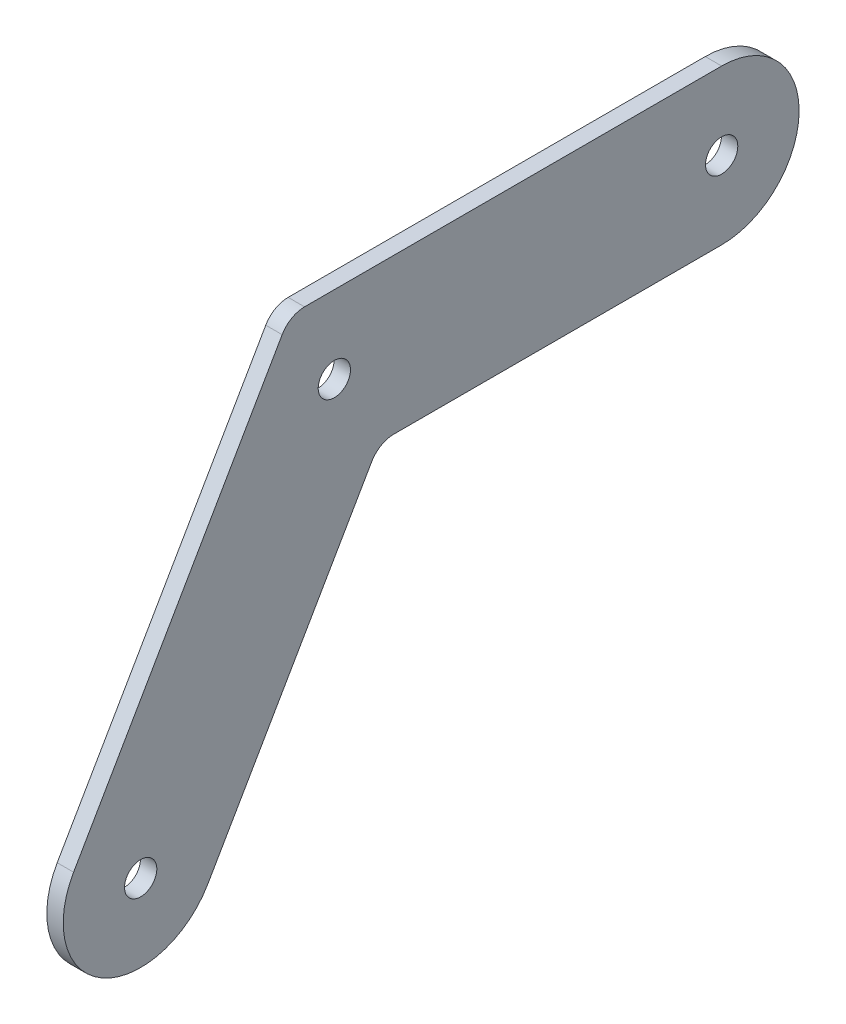
from build123d import *

# Parameters (mm, degrees)
SALIENTE_EXTRUIR1_DEPTH          = 3.175
DI_METRO_DE_TALADRO_6_0_12_5_1_D = 12.5
REDONDEO1_R                      = 10


with BuildPart() as part:
    # Croquis1 → Saliente-Extruir1 (new, symmetric)
    with BuildSketch(Plane(origin=(0, 0, 0), x_dir=(0, 0, -1), z_dir=(1, 0, 0))):
        with BuildLine():
            Line((-17.320508076, 30), (150, 30))
            ThreePointArc((150, 30), (180, 0), (150, -30))
            Line((150, -30), (17.320508076, -30))
            Line((17.320508076, -30), (-49.019237886, -144.903810568))
            ThreePointArc((-49.019237886, -144.903810568), (-90, -155.884572681), (-100.980762114, -114.903810568))
            Line((-100.980762114, -114.903810568), (-17.320508076, 30))
        make_face()
    extrude(amount=SALIENTE_EXTRUIR1_DEPTH, both=True)

    # Diámetro de taladro Ø6.0 (12.5)1 (through all)
    with Locations(Plane(origin=(3.175, 0, 0), x_dir=(0, 0, -1), z_dir=(1, 0, 0))):
        with Locations((0, 0), (-75, -129.903810568), (150, 0)):
            Hole(DI_METRO_DE_TALADRO_6_0_12_5_1_D / 2)

    # Redondeo1
    redondeo1_edges = [part.edges().sort_by_distance(p)[0] for p in [
        (0, 30, 17.320508076),
        (0, -30, -17.320508076),
    ]]
    fillet(redondeo1_edges, radius=REDONDEO1_R)


solid = part.part
